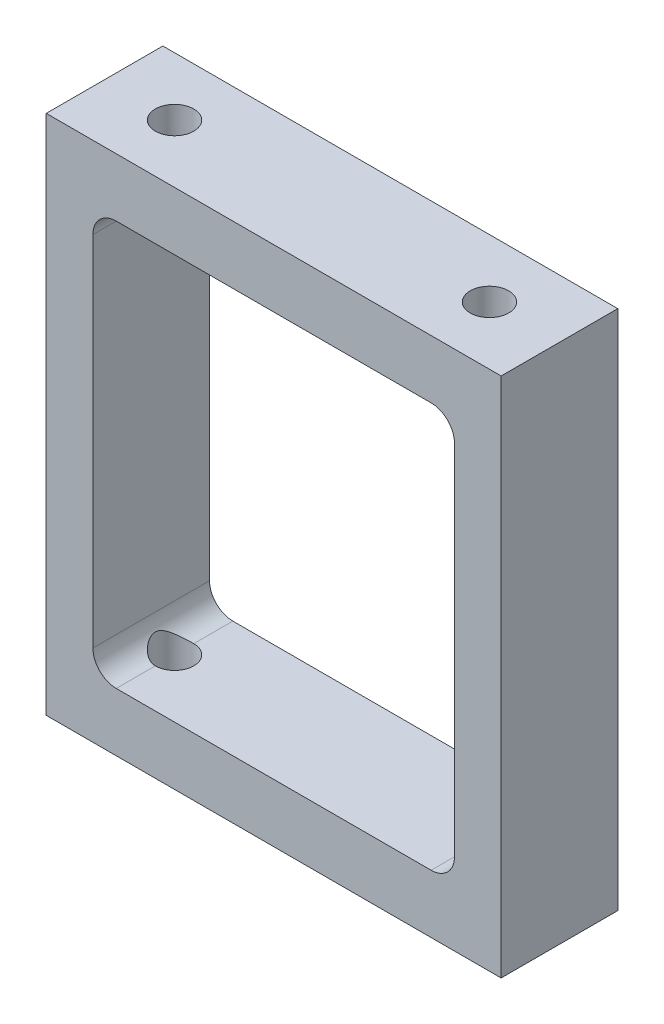
from build123d import *

# Parameters (mm, degrees)
ESQUISSE1_W               = 39
ESQUISSE1_H               = 10
EXTRUSION1_DEPTH          = 22.35
TROU_TARAUD_M4X0_71_D     = 3.3
TROU_TARAUD_M4X0_71_DEPTH = 10.1
TROU_TARAUD_M4X0_71_TIP   = 0.991420021
TROU_TARAUD_M4X0_72_D     = 3.3
TROU_TARAUD_M4X0_72_DEPTH = 10.1
TROU_TARAUD_M4X0_72_TIP   = 0.991420021
ENL_V_MAT_EXTRU_1_DEPTH   = 47.049131371


with BuildPart() as part:
    # Esquisse1 → Extrusion1 (new, symmetric)
    with BuildSketch(Plane(origin=(0, 0, 0), x_dir=(1, 0, 0), z_dir=(0, 1, 0))):
        with Locations((19.5, 0)):
            Rectangle(ESQUISSE1_W, ESQUISSE1_H)
    extrude(amount=EXTRUSION1_DEPTH, both=True)

    # Trou taraudé M4x0.71
    with Locations(Plane.XZ.offset(22.35)):
        with Locations((33, 0), (6, 0)):
            Hole(TROU_TARAUD_M4X0_71_D / 2, depth=TROU_TARAUD_M4X0_71_DEPTH)
            with Locations((0, 0, -(TROU_TARAUD_M4X0_71_DEPTH + TROU_TARAUD_M4X0_71_TIP / 2))):  # 118° drill point
                Cone(0, TROU_TARAUD_M4X0_71_D / 2, TROU_TARAUD_M4X0_71_TIP, mode=Mode.SUBTRACT)

    # Trou taraudé M4x0.72
    with Locations(Plane(origin=(0, 22.35, 0), x_dir=(-1, 0, 0), z_dir=(0, 1, 0))):
        with Locations((-6, 0), (-33, 0)):
            Hole(TROU_TARAUD_M4X0_72_D / 2, depth=TROU_TARAUD_M4X0_72_DEPTH)
            with Locations((0, 0, -(TROU_TARAUD_M4X0_72_DEPTH + TROU_TARAUD_M4X0_72_TIP / 2))):  # 118° drill point
                Cone(0, TROU_TARAUD_M4X0_72_D / 2, TROU_TARAUD_M4X0_72_TIP, mode=Mode.SUBTRACT)

    # Esquisse8 → Enlèv. mat.-Extru.1 (cut, through all)
    with BuildSketch(Plane(origin=(0, 0, -5), x_dir=(-1, 0, 0), z_dir=(0, 0, -1))):
        with BuildLine():
            Line((-33, 17.35), (-6, 17.35))
            ThreePointArc((-6, 17.35), (-4.585786438, 16.764213562), (-4, 15.35))
            Line((-4, 15.35), (-4, -15.35))
            ThreePointArc((-4, -15.35), (-4.585786438, -16.764213562), (-6, -17.35))
            Line((-6, -17.35), (-33, -17.35))
            ThreePointArc((-33, -17.35), (-34.414213562, -16.764213562), (-35, -15.35))
            Line((-35, -15.35), (-35, 15.35))
            ThreePointArc((-35, 15.35), (-34.414213562, 16.764213562), (-33, 17.35))
        make_face()
    extrude(amount=-ENL_V_MAT_EXTRU_1_DEPTH, mode=Mode.SUBTRACT)


solid = part.part
